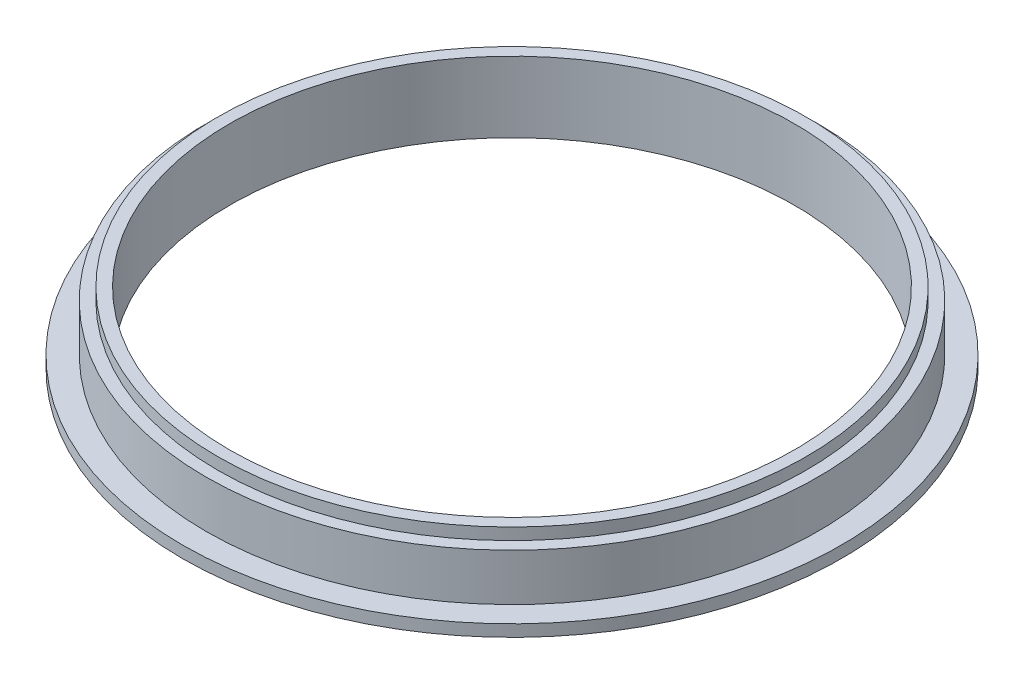
from build123d import *

# Parameters (mm, degrees)
ESQUISSE1_R             = 28
BOSS_EXTRU_2_DEPTH      = 1
ESQUISSE2_R             = 26
ESQUISSE2_R_2           = 24
BOSS_EXTRU_5_DEPTH      = 4
ESQUISSE6_R             = 25
BOSS_EXTRU_6_DEPTH      = 1
ESQUISSE7_R             = 24
ENL_V_MAT_EXTRU_2_DEPTH = 41.049968789


with BuildPart() as part:
    # Esquisse1 → Boss.-Extru.2 (new body)
    with BuildSketch(Plane(origin=(0, 0, 0), x_dir=(1, 0, 0), z_dir=(0, 1, 0))):
        with Locations(Location((0, 0, 0), (0, 0, 270))):
            Circle(ESQUISSE1_R)
    extrude(amount=BOSS_EXTRU_2_DEPTH)

    # Esquisse2 → Boss.-Extru.5 (add)
    with BuildSketch(Plane(origin=(0, 1, 0), x_dir=(1, 0, 0), z_dir=(0, 1, 0))):
        with Locations(Location((0, 0, 0), (0, 0, 270))):
            Circle(ESQUISSE2_R)
        with Locations(Location((0, 0, 0), (0, 0, 270))):
            Circle(ESQUISSE2_R_2, mode=Mode.SUBTRACT)
    extrude(amount=BOSS_EXTRU_5_DEPTH)

    # Esquisse6 → Boss.-Extru.6 (add)
    with BuildSketch(Plane(origin=(0, 5, 0), x_dir=(1, 0, 0), z_dir=(0, 1, 0))):
        with Locations(Location((0, 0, 0), (0, 0, 270))):
            Circle(ESQUISSE6_R)
    extrude(amount=BOSS_EXTRU_6_DEPTH)

    # Esquisse7 → Enlèv. mat.-Extru.2 (cut, through all)
    with BuildSketch(Plane(origin=(0, 6, 0), x_dir=(1, 0, 0), z_dir=(0, 1, 0))):
        with Locations(Location((0, 0, 0), (0, 0, 270))):
            Circle(ESQUISSE7_R)
    extrude(amount=-ENL_V_MAT_EXTRU_2_DEPTH, mode=Mode.SUBTRACT)


solid = part.part
